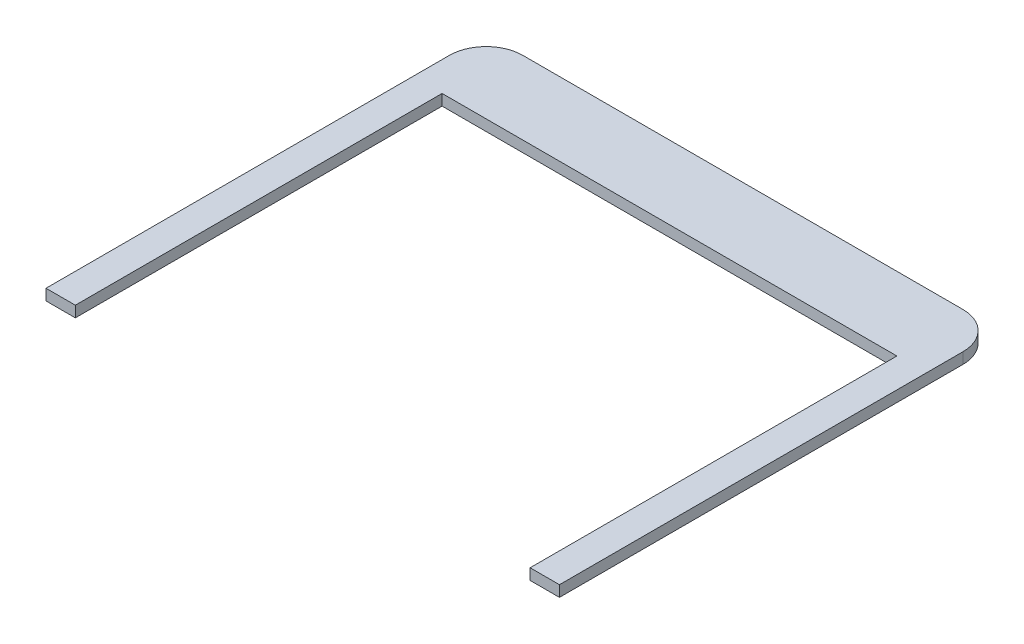
from build123d import *

# Parameters (mm, degrees)
BOSS_EXTRUDE1_DEPTH = 3
FILLET1_R           = 10


with BuildPart() as part:
    # Sketch1 → Boss-Extrude1 (new body)
    with BuildSketch(Plane(origin=(0, 0, 0), x_dir=(1, 0, 0), z_dir=(0, 1, 0))):
        Polygon((77.878787879, 34.242424242), (-62.121212121, 34.242424242), (-62.121212121, -85.757575758), (-54.121212121, -85.757575758), (-54.121212121, 14.242424242), (69.878787879, 14.242424242), (69.878787879, -85.757575758), (77.878787879, -85.757575758), align=None)
    extrude(amount=BOSS_EXTRUDE1_DEPTH)

    # Fillet1
    fillet1_edges = [part.edges().sort_by_distance(p)[0] for p in [
        (77.878787879, 1.5, -34.242424242),
        (-62.121212121, 1.5, -34.242424242),
    ]]
    fillet(fillet1_edges, radius=FILLET1_R)


solid = part.part
